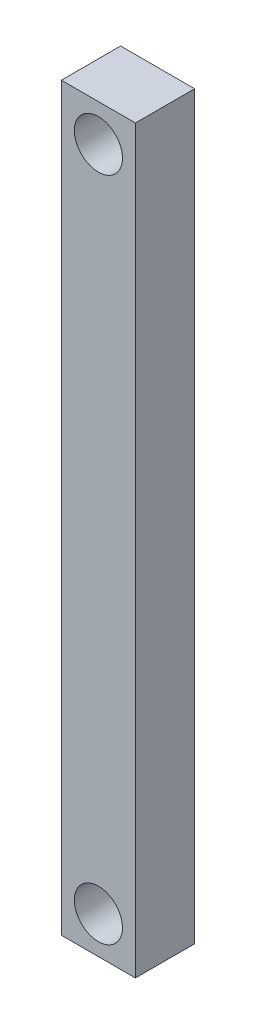
from build123d import *

# Parameters (mm, degrees)
SKETCH1_W           = 5
SKETCH1_H           = 50
SKETCH1_R           = 1.625
BOSS_EXTRUDE1_DEPTH = 4


with BuildPart() as part:
    # Sketch1 → Boss-Extrude1 (new body)
    with BuildSketch(Plane.XY):
        Rectangle(SKETCH1_W, SKETCH1_H)
        with Locations((0, 22.5)):
            Circle(SKETCH1_R, mode=Mode.SUBTRACT)
        with Locations(Location((0, -22.5, 0), (0, 0, 180))):
            Circle(SKETCH1_R, mode=Mode.SUBTRACT)
    extrude(amount=BOSS_EXTRUDE1_DEPTH)


solid = part.part
